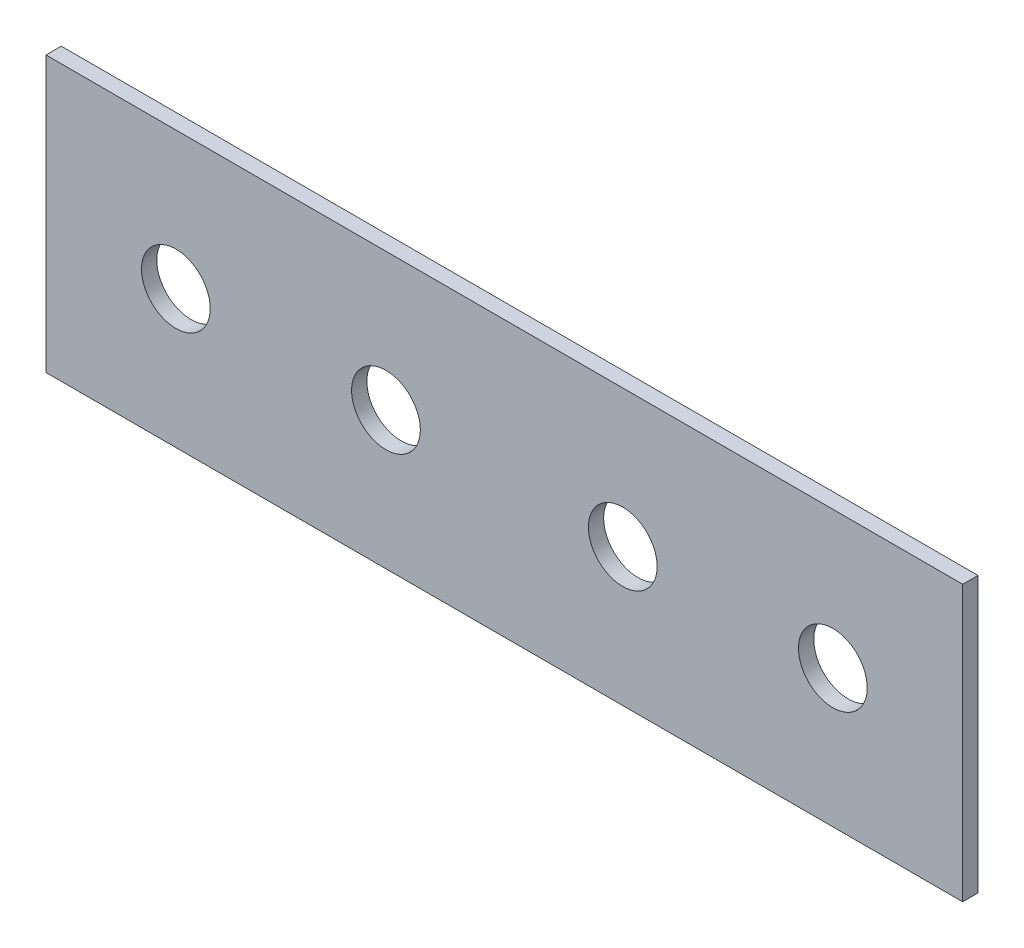
from build123d import *

# Parameters (mm, degrees)
SKETCH_1_W      = 120
SKETCH_1_H      = 36
SKETCH_1_R      = 4.5
EXTRUDE_1_DEPTH = 2


with BuildPart() as part:
    # 草图1 → 凸台-拉伸1 (new body)
    with BuildSketch(Plane.XY):
        with Locations((60, 18)):
            Rectangle(SKETCH_1_W, SKETCH_1_H)
        with Locations((17, 18)):
            Circle(SKETCH_1_R, mode=Mode.SUBTRACT)
        with Locations((44.5, 18)):
            Circle(SKETCH_1_R, mode=Mode.SUBTRACT)
        with Locations((75.5, 18)):
            Circle(SKETCH_1_R, mode=Mode.SUBTRACT)
        with Locations((103, 18)):
            Circle(SKETCH_1_R, mode=Mode.SUBTRACT)
    extrude(amount=EXTRUDE_1_DEPTH)


solid = part.part
